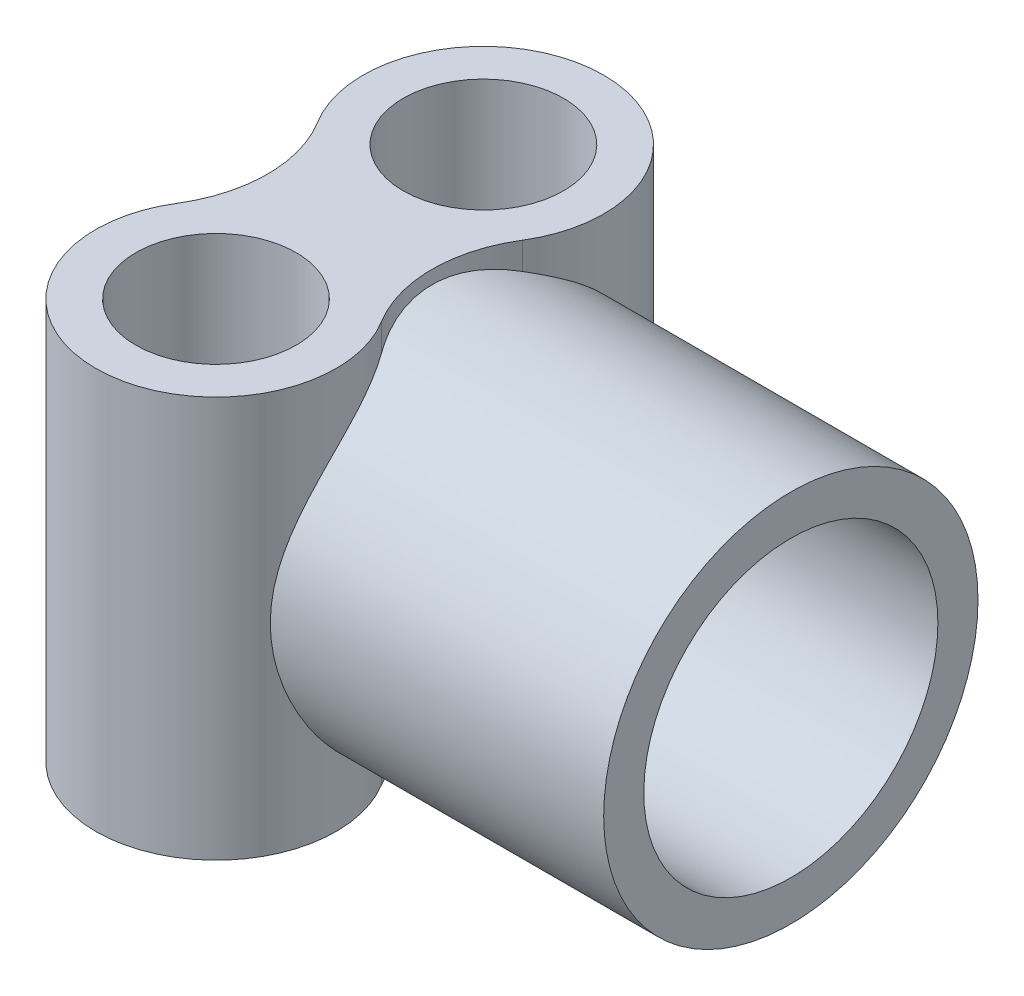
from build123d import *

# Parameters (mm, degrees)
SKETCH1_R                = 6
BOSS_EXTRUDE1_DEPTH      = 30
BOSS_EXTRUDE2_DEPTH      = 23
BOSS_EXTRUDE2_DEPTH_BACK = 4
SKETCH2_R                = 14
SKETCH2_R_2              = 11


with BuildPart() as part:
    # Sketch1 → Boss-Extrude1 (new body)
    with BuildSketch(Plane(origin=(0, 0, 0), x_dir=(1, 0, 0), z_dir=(0, 1, 0))):
        with BuildLine():
            ThreePointArc((7.652602621, 5.263157895), (0, 19), (-7.652602621, 5.263157895))
            ThreePointArc((-7.652602621, 5.263157895), (-6.155494421, 0), (-7.652602621, -5.263157895))
            ThreePointArc((-7.652602621, -5.263157895), (0, -19), (7.652602621, -5.263157895))
            ThreePointArc((7.652602621, -5.263157895), (6.155494421, 0), (7.652602621, 5.263157895))
        make_face()
        with Locations(Location((0, 10, 0), (0, 0, 270))):
            Circle(SKETCH1_R, mode=Mode.SUBTRACT)
        with Locations(Location((0, -10, 0), (0, 0, 270))):
            Circle(SKETCH1_R, mode=Mode.SUBTRACT)
    extrude(amount=BOSS_EXTRUDE1_DEPTH)

    # Sketch2 → Boss-Extrude2 (add, two sides: drawn at the far end of the back side and taken through both)
    with BuildSketch(Plane(origin=(10, 0, 0), x_dir=(0, 0, -1), z_dir=(1, 0, 0)).offset(-BOSS_EXTRUDE2_DEPTH_BACK)):
        with Locations(Location((0, 15, 0), (0, 0, 112.082413194))):
            Circle(SKETCH2_R)
        with Locations(Location((0, 15, 0), (0, 0, 118.585451093))):
            Circle(SKETCH2_R_2, mode=Mode.SUBTRACT)
    extrude(amount=BOSS_EXTRUDE2_DEPTH + BOSS_EXTRUDE2_DEPTH_BACK)


solid = part.part
